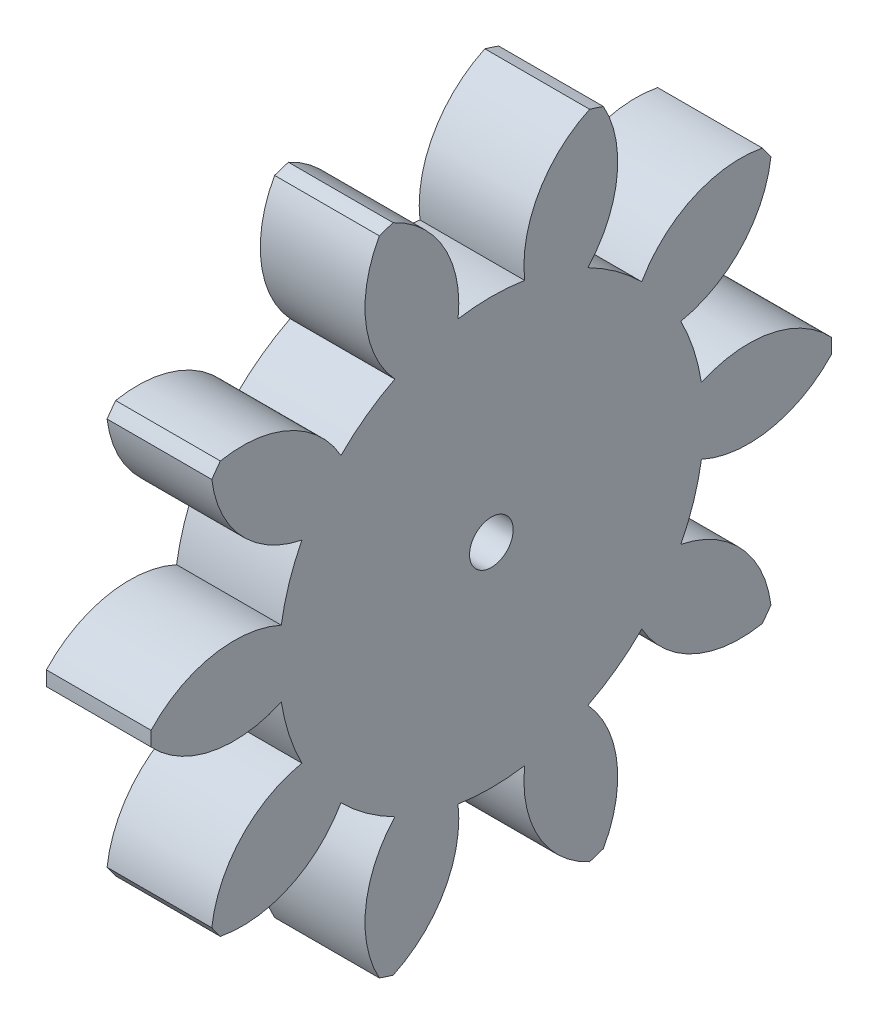
from build123d import *

# Parameters (mm, degrees)
BASPROSKE_W           = 12
BASPROSKE_H           = 39
TOOTHCUT_DEPTH        = 57.444663167
TEETHCUTS_COUNT       = 10
TEETHCUTS_ANGLE       = 324
BORSKE_R              = 1.5
BORE_DEPTH            = 50.0000508
CROQUIS1_R            = 2.5
CORTAR_EXTRUIR1_DEPTH = 56.31066802


with BuildPart() as part:
    # BasProSke → Base-Revolve (revolve)
    with BuildSketch(Plane(origin=(0, 0, 0), x_dir=(1, 0, 0), z_dir=(0, 1, 0)), mode=Mode.PRIVATE) as base_revolve_sk:
        with Locations((6, 19.5)):
            Rectangle(BASPROSKE_W, BASPROSKE_H)
    revolve(base_revolve_sk.sketch.rotate(Axis((-10, 0, 0), (1, 0, 0)), 180), axis=Axis((-10, 0, 0), (1, 0, 0)))

    # TooCutSke → ToothCut (cut, through all)
    with BuildSketch(Plane(origin=(0, 0, 0), x_dir=(0, 0, -1), z_dir=(1, 0, 0))):
        with BuildLine():
            ThreePointArc((3.815775932, 24.073465269), (0, 24.374), (-3.815775932, 24.073465269))
            ThreePointArc((-3.815775932, 24.073465269), (-5.403120307, 31.925375456), (-11.292153099, 37.355978418))
            ThreePointArc((-11.292153099, 37.355978418), (0, 39.0254), (11.292153099, 37.355978418))
            ThreePointArc((11.292153099, 37.355978418), (5.403120307, 31.925375456), (3.815775932, 24.073465269))
        make_face()
    toothcut = extrude(amount=TOOTHCUT_DEPTH, mode=Mode.SUBTRACT)

    # TeethCuts: ToothCut ×10 about axis
    teethcuts_axis = Axis((-10, 0, 0), (1, 0, 0))
    for i in range(1, TEETHCUTS_COUNT):
        add(toothcut.rotate(teethcuts_axis, i * TEETHCUTS_ANGLE / (TEETHCUTS_COUNT - 1)), mode=Mode.SUBTRACT)

    # BorSke → Bore (cut, symmetric)
    with BuildSketch(Plane(origin=(0, 0, 0), x_dir=(0, 0, -1), z_dir=(1, 0, 0))):
        with Locations(Location((0, 0, 0), (0, 0, 180))):
            Circle(BORSKE_R)
    extrude(amount=BORE_DEPTH, both=True, mode=Mode.SUBTRACT)

    # Croquis1 → Cortar-Extruir1 (cut, through all)
    with BuildSketch(Plane.YZ.offset(12)):
        with Locations(Location((0, 0, 0), (0, 0, 270))):
            Circle(CROQUIS1_R)
    extrude(amount=-CORTAR_EXTRUIR1_DEPTH, mode=Mode.SUBTRACT)


solid = part.part
